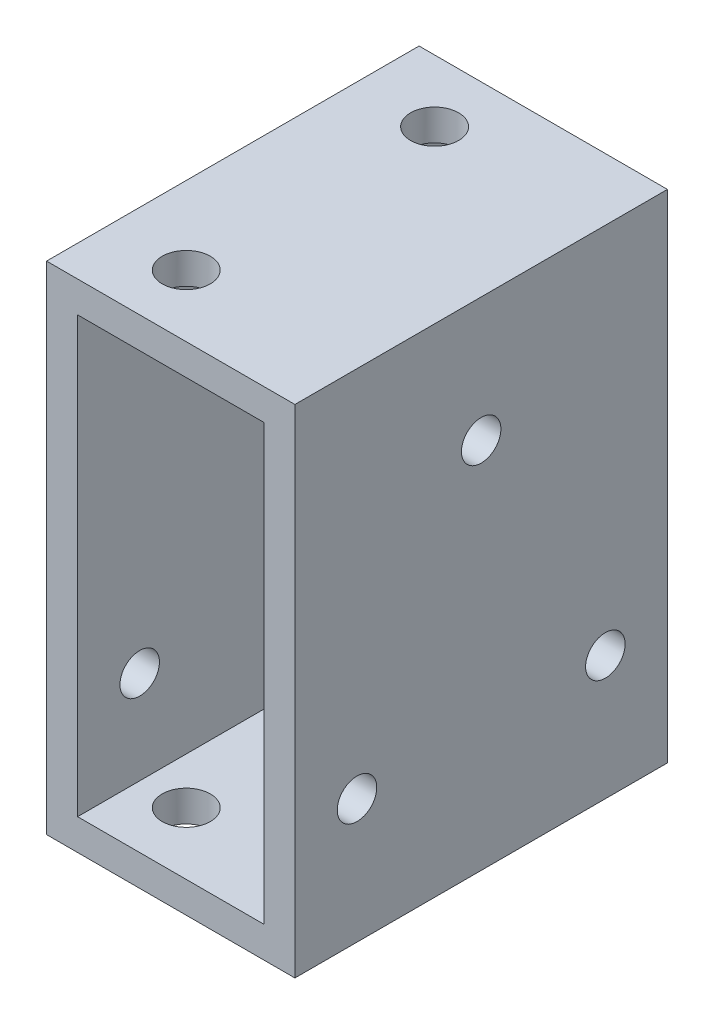
from build123d import *

# Parameters (mm, degrees)
SKETCH1_W                    = 25.4
SKETCH1_H                    = 50.8
SKETCH1_W_2                  = 19.05
SKETCH1_H_2                  = 44.45
BOSS_EXTRUDE1_DEPTH          = 19.05
F_10_0_1935_DIAMETER_HOLE1_D = 4.9149
F_10_32_TAPPED_HOLE1_D       = 4.0386


with BuildPart() as part:
    # Sketch1 → Boss-Extrude1 (new, symmetric)
    with BuildSketch(Plane.XY):
        Rectangle(SKETCH1_W, SKETCH1_H)
        Rectangle(SKETCH1_W_2, SKETCH1_H_2, mode=Mode.SUBTRACT)
    extrude(amount=BOSS_EXTRUDE1_DEPTH, both=True)

    # #10 (0.1935) Diameter Hole1 (through all)
    with Locations(Plane(origin=(0, 25.4, 0), x_dir=(1, 0, 0), z_dir=(0, 1, 0))):
        with Locations((-4.7625, -12.7), (-4.7625, 12.7)):
            Hole(F_10_0_1935_DIAMETER_HOLE1_D / 2)

    # #10-32 Tapped Hole1 (through all)
    with Locations(Plane.ZY.offset(12.7)):
        with Locations((-12.7, -12.7), (12.7, -12.7), (0, 12.7)):
            Hole(F_10_32_TAPPED_HOLE1_D / 2)


solid = part.part
